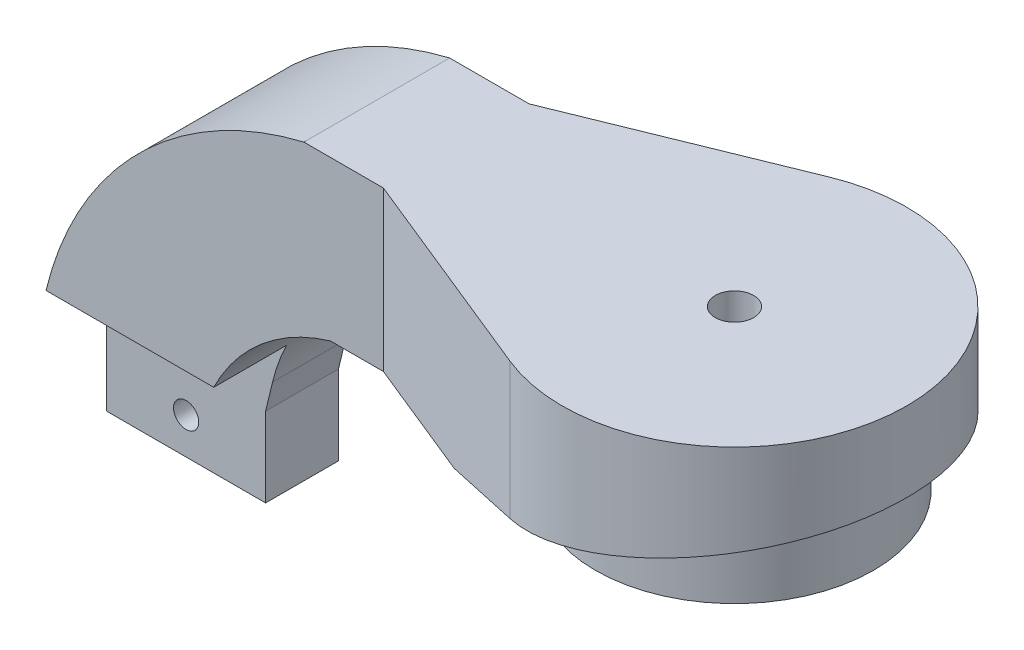
from build123d import *

# Parameters (mm, degrees)
BOSS_EXTRUDE1_DEPTH = 24
CUT_EXTRUDE1_DEPTH  = 29.5
SKETCH3_R           = 21
BOSS_EXTRUDE2_DEPTH = 24
CUT_EXTRUDE2_DEPTH  = 4
BOSS_EXTRUDE3_DEPTH = 11
SKETCH6_W           = 89
SKETCH6_H           = 21.5
SKETCH7_W           = 48
SKETCH7_H           = 22
BOSS_EXTRUDE4_DEPTH = 3.027047
SKETCH8_R           = 18.5
CUT_EXTRUDE3_DEPTH  = 83
CUT_EXTRUDE4_REACH  = 138.005
SKETCH9_R           = 1.6
SKETCH9_R_2         = 6.1
CUT_EXTRUDE5_REACH  = 161.788
SKETCH10_R          = 2.9
CUT_EXTRUDE6_REACH  = 170.915
SKETCH13_R          = 1.9
CUT_EXTRUDE7_DEPTH  = 106.047905434


with BuildPart() as part:
    # Sketch1 → Boss-Extrude1 (new body)
    with BuildSketch(Plane(origin=(0, 0, 0), x_dir=(1, 0, 0), z_dir=(0, 1, 0))):
        with BuildLine():
            Line((-42, 0), (-42, 11))
            Line((-42, 11), (-9.786517927, 24.087840644))
            ThreePointArc((-9.786517927, 24.087840644), (26, 0), (-9.786517927, -24.087840644))
            Line((-9.786517927, -24.087840644), (-42, -11))
            Line((-42, -11), (-42, 0))
        make_face()
    extrude(amount=BOSS_EXTRUDE1_DEPTH)

    # Sketch2 → Cut-Extrude1 (cut, symmetric)
    with BuildSketch(Plane.XY):
        Polygon((-24, 0), (26, 12), (26, 0), align=None)
    extrude(amount=CUT_EXTRUDE1_DEPTH, both=True, mode=Mode.SUBTRACT)

    # Sketch3 → Boss-Extrude2 (add)
    with BuildSketch(Plane(origin=(0, 24, 0), x_dir=(1, 0, 0), z_dir=(0, 1, 0))):
        with Locations(Location((0, 0, 0), (0, 0, 270))):
            Circle(SKETCH3_R)
    extrude(amount=-BOSS_EXTRUDE2_DEPTH)

    # Sketch4 → Cut-Extrude2 (cut)
    with BuildSketch(Plane.XZ):
        Polygon((2.829016319, 4.9), (-2.829016319, 4.9), (-5.658032638, 0), (-2.829016319, -4.9), (2.829016319, -4.9), (5.658032638, 0), align=None)
    extrude(amount=-CUT_EXTRUDE2_DEPTH, mode=Mode.SUBTRACT)

    # Sketch5 → Boss-Extrude3 (add, symmetric)
    with BuildSketch(Plane.XY):
        with BuildLine():
            ThreePointArc((-54, 24), (-78.945219608, 10.049710337), (-92.941825352, -14.869551102))
            Line((-92.941825352, -14.869551102), (-94.786517927, -22.5))
            Line((-94.786517927, -22.5), (-94.786517927, -37.075307894))
            Line((-94.786517927, -37.075307894), (-93.178015205, -46.5))
            Line((-93.178015205, -46.5), (-90, -56.5))
            Line((-90, -56.5), (-42, -56.5))
            Line((-42, -56.5), (-63.178015205, -46.5))
            Line((-63.178015205, -46.5), (-70.786517927, -37.075307894))
            Line((-70.786517927, -37.075307894), (-70.786517927, -25.075307894))
            Line((-70.786517927, -25.075307894), (-69.738862808, -20.741751748))
            ThreePointArc((-69.738862808, -20.741751748), (-62.647337683, -7.727284744), (-50, 0))
            Line((-50, 0), (-42, 0))
            Line((-42, 0), (-42, 24))
            Line((-42, 24), (-54, 24))
        make_face()
    extrude(amount=BOSS_EXTRUDE3_DEPTH, both=True)



with BuildPart() as body_2:
    # Sketch6 → Revolve1 (revolve)
    with BuildSketch(Plane.XY):
        with Locations((-53.5, -88.75)):
            Rectangle(SKETCH6_W, SKETCH6_H)
    revolve(axis=Axis((-98, -78, 0), (1, 0, 0)))


with BuildPart() as part_1:
    add(part.part)

    add(body_2.part)  # Boss-Extrude4 merges body 2
    # Sketch7 → Boss-Extrude4 (add)
    with BuildSketch(Plane.XZ.offset(56.5)):
        with Locations((-66, 0)):
            Rectangle(SKETCH7_W, SKETCH7_H)
    extrude(amount=BOSS_EXTRUDE4_DEPTH)

    # Sketch8 → Cut-Extrude3 (cut)
    with BuildSketch(Plane.ZY.offset(98)):
        with Locations((0, -78)):
            Circle(SKETCH8_R)
    extrude(amount=-CUT_EXTRUDE3_DEPTH, mode=Mode.SUBTRACT)

    # Sketch9 → Cut-Extrude4 (cut, up to next)
    with BuildSketch(Plane(origin=(-9, 0, 0), x_dir=(0, 0, -1), z_dir=(1, 0, 0)), mode=Mode.PRIVATE) as cut_extrude4_sk1:
        with Locations((15.5, -78)):
            Circle(SKETCH9_R)
    cut_extrude4_tool1 = extrude(cut_extrude4_sk1.sketch, amount=-CUT_EXTRUDE4_REACH, mode=Mode.PRIVATE) & part_1.part
    # Sketch9 → Cut-Extrude4 (cut, up to next)
    with BuildSketch(Plane(origin=(-9, 0, 0), x_dir=(0, 0, -1), z_dir=(1, 0, 0)), mode=Mode.PRIVATE) as cut_extrude4_sk2:
        with Locations((7.75, -91.423393759)):
            Circle(SKETCH9_R)
    cut_extrude4_tool2 = extrude(cut_extrude4_sk2.sketch, amount=-CUT_EXTRUDE4_REACH, mode=Mode.PRIVATE) & part_1.part
    # Sketch9 → Cut-Extrude4 (cut, up to next)
    with BuildSketch(Plane(origin=(-9, 0, 0), x_dir=(0, 0, -1), z_dir=(1, 0, 0)), mode=Mode.PRIVATE) as cut_extrude4_sk3:
        with Locations((-7.75, -91.423393759)):
            Circle(SKETCH9_R)
    cut_extrude4_tool3 = extrude(cut_extrude4_sk3.sketch, amount=-CUT_EXTRUDE4_REACH, mode=Mode.PRIVATE) & part_1.part
    # Sketch9 → Cut-Extrude4 (cut, up to next)
    with BuildSketch(Plane(origin=(-9, 0, 0), x_dir=(0, 0, -1), z_dir=(1, 0, 0)), mode=Mode.PRIVATE) as cut_extrude4_sk4:
        with Locations((-15.5, -78)):
            Circle(SKETCH9_R)
    cut_extrude4_tool4 = extrude(cut_extrude4_sk4.sketch, amount=-CUT_EXTRUDE4_REACH, mode=Mode.PRIVATE) & part_1.part
    # Sketch9 → Cut-Extrude4 (cut, up to next)
    with BuildSketch(Plane(origin=(-9, 0, 0), x_dir=(0, 0, -1), z_dir=(1, 0, 0)), mode=Mode.PRIVATE) as cut_extrude4_sk5:
        with Locations((-7.75, -64.576606241)):
            Circle(SKETCH9_R)
    cut_extrude4_tool5 = extrude(cut_extrude4_sk5.sketch, amount=-CUT_EXTRUDE4_REACH, mode=Mode.PRIVATE) & part_1.part
    # Sketch9 → Cut-Extrude4 (cut, up to next)
    with BuildSketch(Plane(origin=(-9, 0, 0), x_dir=(0, 0, -1), z_dir=(1, 0, 0)), mode=Mode.PRIVATE) as cut_extrude4_sk6:
        with Locations((7.75, -64.576606241)):
            Circle(SKETCH9_R)
    cut_extrude4_tool6 = extrude(cut_extrude4_sk6.sketch, amount=-CUT_EXTRUDE4_REACH, mode=Mode.PRIVATE) & part_1.part
    # Sketch9 → Cut-Extrude4 (cut, up to next)
    with BuildSketch(Plane(origin=(-9, 0, 0), x_dir=(0, 0, -1), z_dir=(1, 0, 0)), mode=Mode.PRIVATE) as cut_extrude4_sk7:
        with Locations((0, -85)):
            Circle(SKETCH9_R_2)
    cut_extrude4_tool7 = extrude(cut_extrude4_sk7.sketch, amount=-CUT_EXTRUDE4_REACH, mode=Mode.PRIVATE) & part_1.part
    add(cut_extrude4_tool1.solids().sort_by_distance((-9, -78, -15.5))[0], mode=Mode.SUBTRACT)
    add(cut_extrude4_tool2.solids().sort_by_distance((-9, -91.423394, -7.75))[0], mode=Mode.SUBTRACT)
    add(cut_extrude4_tool3.solids().sort_by_distance((-9, -91.423394, 7.75))[0], mode=Mode.SUBTRACT)
    add(cut_extrude4_tool4.solids().sort_by_distance((-9, -78, 15.5))[0], mode=Mode.SUBTRACT)
    add(cut_extrude4_tool5.solids().sort_by_distance((-9, -64.576606, 7.75))[0], mode=Mode.SUBTRACT)
    add(cut_extrude4_tool6.solids().sort_by_distance((-9, -64.576606, -7.75))[0], mode=Mode.SUBTRACT)
    add(cut_extrude4_tool7.solids().sort_by_distance((-9, -85, 0))[0], mode=Mode.SUBTRACT)

    # Sketch10 → Cut-Extrude5 (cut, up to next)
    with BuildSketch(Plane(origin=(0, 24, 0), x_dir=(1, 0, 0), z_dir=(0, 1, 0)), mode=Mode.PRIVATE) as cut_extrude5_sk1:
        with Locations(Location((0, 0, 0), (0, 0, 270))):
            Circle(SKETCH10_R)
    cut_extrude5_tool1 = extrude(cut_extrude5_sk1.sketch, amount=-CUT_EXTRUDE5_REACH, mode=Mode.PRIVATE) & part_1.part
    add(cut_extrude5_tool1.solids().sort_by_distance((0, 24, 0))[0], mode=Mode.SUBTRACT)

    # Sketch12 → Cut-Extrude6 (cut, up to next)
    with BuildSketch(Plane.ZY.offset(108), mode=Mode.PRIVATE) as cut_extrude6_sk1:
        Polygon((0, -14.869551102), (0, -37.075307894), (-35.009935155, -37.075307894), (-35.009935155, -113.334550455), (34.515095082, -113.334550455), (34.515095082, -14.869551102), align=None)
    cut_extrude6_tool1 = extrude(cut_extrude6_sk1.sketch, amount=-CUT_EXTRUDE6_REACH, mode=Mode.PRIVATE) & part_1.part
    add(cut_extrude6_tool1.solids().sort_by_distance((-108, -68.986865, 1.963457))[0], mode=Mode.SUBTRACT)

    # Sketch13 → Cut-Extrude7 (cut, through all)
    with BuildSketch(Plane.XY):
        with Locations((-81.960177429, -20.369551102)):
            Circle(SKETCH13_R)
        with Locations((-82.786517927, -31.575307894)):
            Circle(SKETCH13_R)
    extrude(amount=-CUT_EXTRUDE7_DEPTH, mode=Mode.SUBTRACT)


solid = part_1.part
